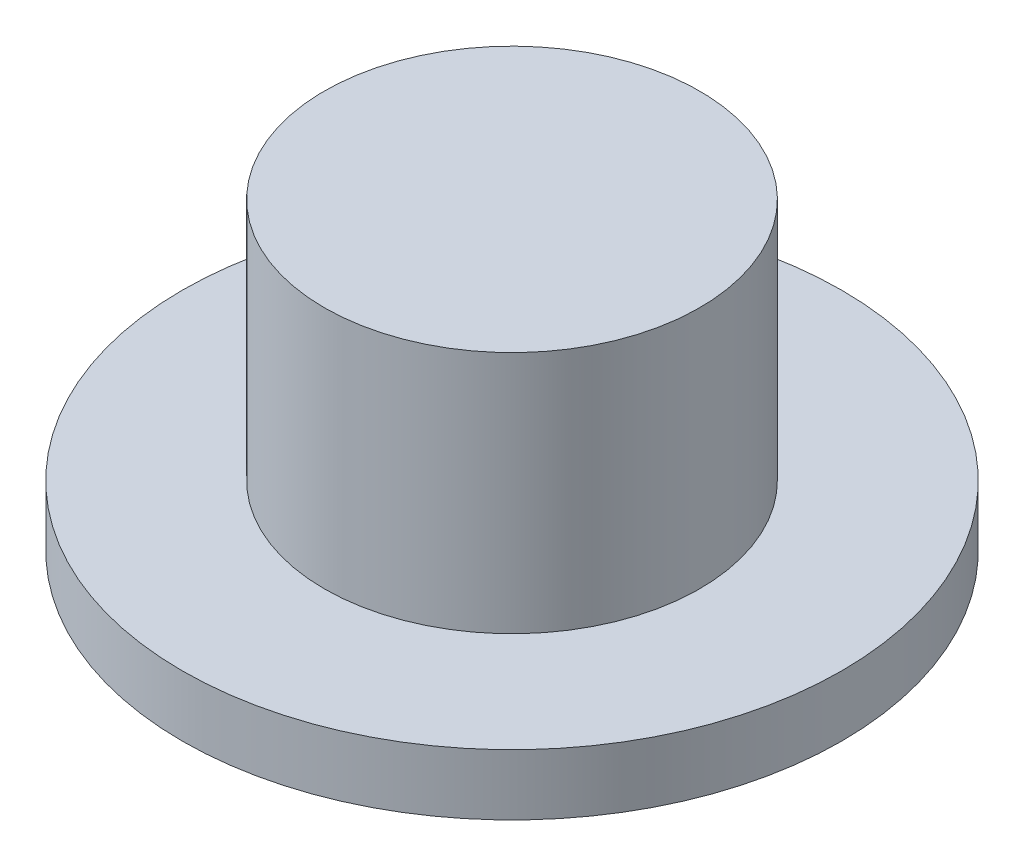
from build123d import *

# Parameters (mm, degrees)
SKETCH1_R           = 6.5
BOSS_EXTRUDE1_DEPTH = 1.2
SKETCH2_R           = 3.7
BOSS_EXTRUDE2_DEPTH = 4.8


with BuildPart() as part:
    # Sketch1 → Boss-Extrude1 (new body)
    with BuildSketch(Plane(origin=(0, 0, 0), x_dir=(1, 0, 0), z_dir=(0, 1, 0))):
        with Locations(Location((0, 0, 0), (0, 0, 270))):
            Circle(SKETCH1_R)
    extrude(amount=BOSS_EXTRUDE1_DEPTH)

    # Sketch2 → Boss-Extrude2 (add)
    with BuildSketch(Plane(origin=(0, 1.2, 0), x_dir=(1, 0, 0), z_dir=(0, 1, 0))):
        with Locations(Location((0, 0, 0), (0, 0, 270))):
            Circle(SKETCH2_R)
    extrude(amount=BOSS_EXTRUDE2_DEPTH)


solid = part.part
